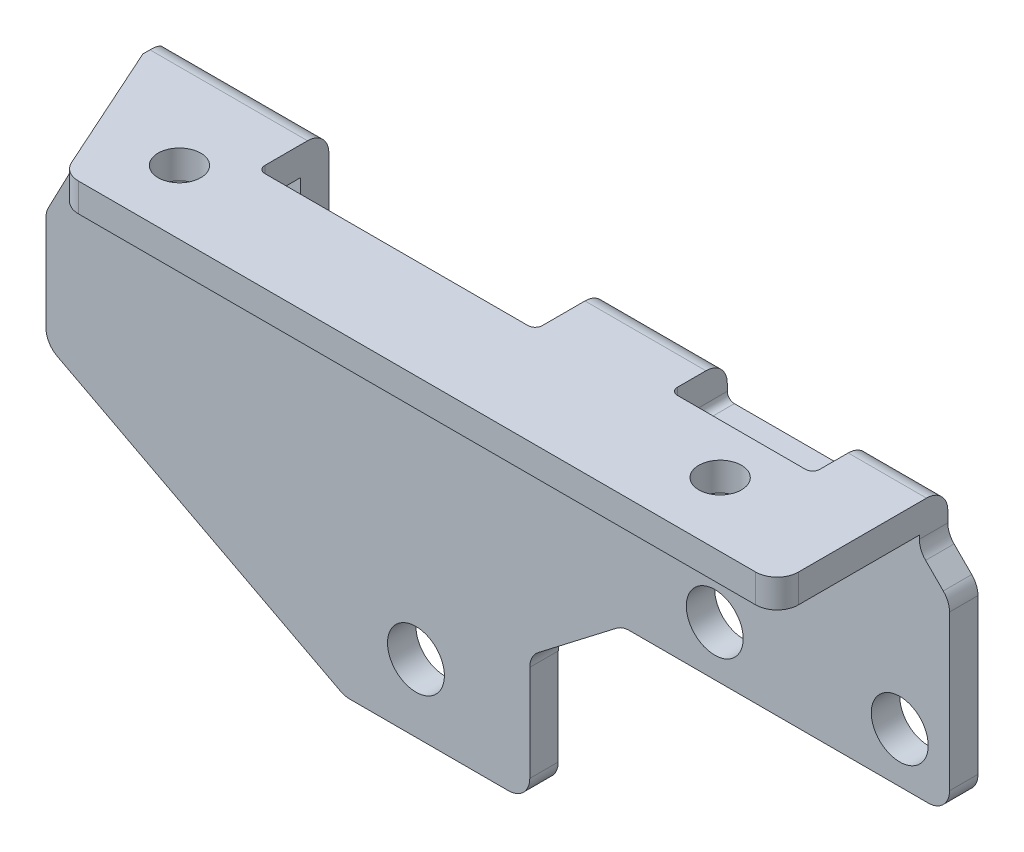
from build123d import *

# Parameters (mm, degrees)
SKETCH1_R           = 2
BOSS_EXTRUDE1_DEPTH = 2
SKETCH2_W           = 54.569155846
SKETCH2_H           = 2
BOSS_EXTRUDE2_DEPTH = 10
SKETCH3_R           = 1.5
CUT_EXTRUDE1_DEPTH  = 73.112758927
SKETCH4_W           = 19.5
SKETCH4_H           = 5
SKETCH4_W_2         = 10
SKETCH4_H_2         = 4
CUT_EXTRUDE2_DEPTH  = 2.5
SKETCH5_W           = 19.5
SKETCH5_H           = 2
CUT_EXTRUDE3_DEPTH  = 4.5
FILLET1_R           = 1.5
FILLET2_R           = 0.5


with BuildPart() as part:
    # Sketch1 → Boss-Extrude1 (new body)
    with BuildSketch(Plane.XY):
        Polygon((0, 0), (21, -11), (27.728873239, -11), (34, -11), (34, -2), (40.5, 3), (63.5, 3), (63.5, 16), (61.378679656, 18.121320344), (61.378679656, 21), (6.80952381, 21), (0, 8), align=None)
        with Locations((26, -6.25)):
            Circle(SKETCH1_R, mode=Mode.SUBTRACT)
        with Locations((47, 6.5)):
            Circle(SKETCH1_R, mode=Mode.SUBTRACT)
        with Locations((60, 6.5)):
            Circle(SKETCH1_R, mode=Mode.SUBTRACT)
        with Locations((7.5, 16)):
            Circle(SKETCH1_R, mode=Mode.SUBTRACT)
    extrude(amount=BOSS_EXTRUDE1_DEPTH)

    # Sketch2 → Boss-Extrude2 (add)
    with BuildSketch(Plane.XY.offset(2)):
        with Locations((34.094101733, 20)):
            Rectangle(SKETCH2_W, SKETCH2_H)
    extrude(amount=BOSS_EXTRUDE2_DEPTH)

    # Sketch3 → Cut-Extrude1 (cut, through all)
    with BuildSketch(Plane(origin=(0, 21, 0), x_dir=(1, 0, 0), z_dir=(0, 1, 0))):
        with Locations(Location((52.878679656, -7.5, 0), (0, 0, 270))):
            Circle(SKETCH3_R)
        with Locations(Location((14.878679656, -7.5, 0), (0, 0, 270))):
            Circle(SKETCH3_R)
        Polygon((6.80952381, -2), (11.30952381, -12), (6.80952381, -12), align=None)
    extrude(amount=-CUT_EXTRUDE1_DEPTH, mode=Mode.SUBTRACT)

    # Sketch4 → Cut-Extrude2 (cut)
    with BuildSketch(Plane(origin=(0, 21, 0), x_dir=(1, 0, 0), z_dir=(0, 1, 0))):
        with Locations((27.628679656, -2.5)):
            Rectangle(SKETCH4_W, SKETCH4_H)
        with Locations((50.878679656, -2)):
            Rectangle(SKETCH4_W_2, SKETCH4_H_2)
    extrude(amount=-CUT_EXTRUDE2_DEPTH, mode=Mode.SUBTRACT)

    # Sketch5 → Cut-Extrude3 (cut)
    with BuildSketch(Plane(origin=(0, 18.5, 0), x_dir=(1, 0, 0), z_dir=(0, 1, 0))):
        with Locations((27.628679656, -1)):
            Rectangle(SKETCH5_W, SKETCH5_H)
    extrude(amount=-CUT_EXTRUDE3_DEPTH, mode=Mode.SUBTRACT)

    # Fillet1
    fillet1_edges = [part.edges().sort_by_distance(p)[0] for p in [
        (58.628679656, 21, 0),
        (0, 8, 1),
        (61.378679656, 18.121320344, 1),
        (63.5, 16, 1),
        (63.5, 3, 1),
        (40.5, 3, 1),
        (34, -2, 1),
        (34, -11, 1),
        (21, -11, 1),
        (0, 0, 1),
        (61.378679656, 20, 12),
        (11.30952381, 20, 12),
        (41.628679656, 21, 0),
        (12.344101733, 21, 0),
    ]]
    fillet(fillet1_edges, radius=FILLET1_R)

    # Fillet2
    fillet2_edges = [part.edges().sort_by_distance(p)[0] for p in [
        (37.378679656, 20, 5),
        (37.378679656, 14, 1),
        (55.878679656, 20, 4),
        (45.878679656, 20, 4),
        (45.878679656, 18.5, 1),
        (55.878679656, 18.5, 1),
        (17.878679656, 14, 1),
        (17.878679656, 20, 5),
    ]]
    fillet(fillet2_edges, radius=FILLET2_R)


solid = part.part
